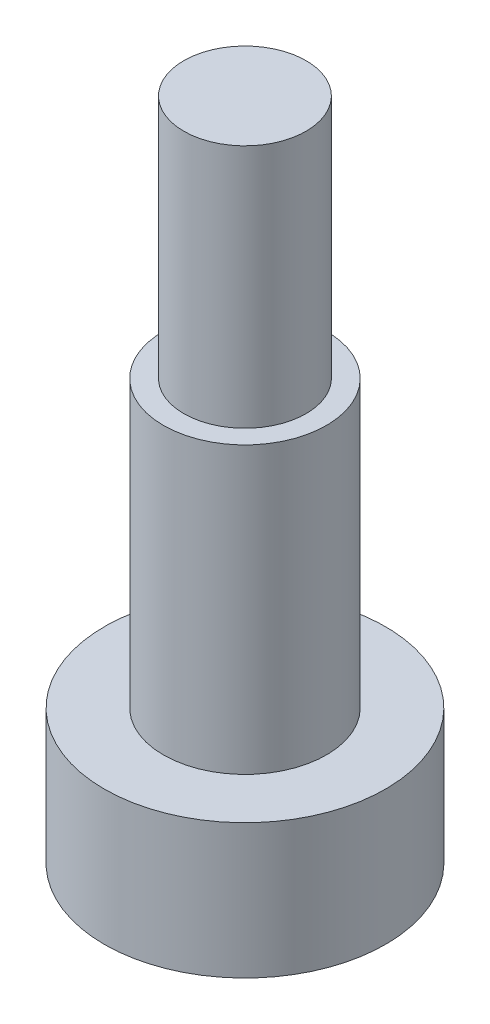
from build123d import *

# Parameters (mm, degrees)
SKETCH_1_R      = 3.45
EXTRUDE_1_DEPTH = 3.3
SKETCH_2_R      = 2
EXTRUDE_2_DEPTH = 7
SKETCH_3_R      = 1.5
EXTRUDE_3_DEPTH = 6


with BuildPart() as part:
    # 草图1 → 凸台-拉伸1 (new body)
    with BuildSketch(Plane(origin=(0, 0, 0), x_dir=(1, 0, 0), z_dir=(0, 1, 0))):
        with Locations(Location((0, 0, 0), (0, 0, 270))):
            Circle(SKETCH_1_R)
    extrude(amount=EXTRUDE_1_DEPTH)

    # 草图2 → 凸台-拉伸2 (add)
    with BuildSketch(Plane(origin=(0, 3.3, 0), x_dir=(1, 0, 0), z_dir=(0, 1, 0))):
        with Locations(Location((0, 0, 0), (0, 0, 270))):
            Circle(SKETCH_2_R)
    extrude(amount=EXTRUDE_2_DEPTH)

    # 草图3 → 凸台-拉伸3 (add)
    with BuildSketch(Plane(origin=(0, 10.3, 0), x_dir=(1, 0, 0), z_dir=(0, 1, 0))):
        with Locations(Location((0, 0, 0), (0, 0, 270))):
            Circle(SKETCH_3_R)
    extrude(amount=EXTRUDE_3_DEPTH)


solid = part.part
